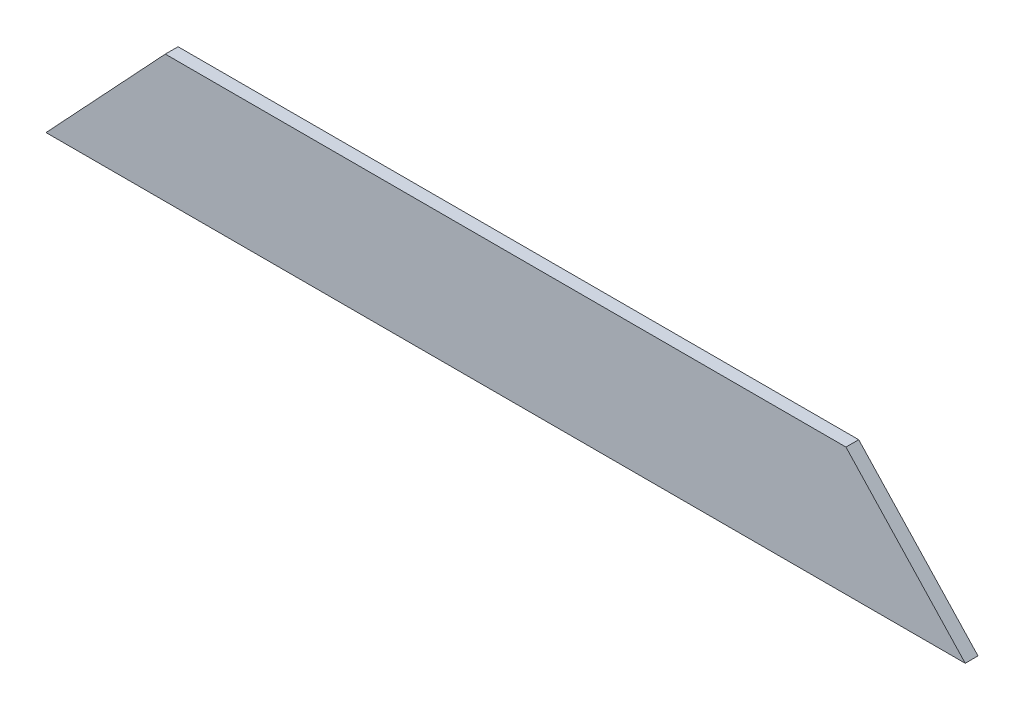
from build123d import *

# Parameters (mm, degrees)
BOSS_EXTRUDE1_DEPTH = 2


with BuildPart() as part:
    # Sketch1 → Boss-Extrude1 (new body)
    with BuildSketch(Plane.XY):
        Polygon((47.646518135, 64.918892489), (154.314948326, 64.918892489), (173.0106005, 44.918892489), (28.950865961, 44.918892489), align=None)
    extrude(amount=BOSS_EXTRUDE1_DEPTH)


solid = part.part
